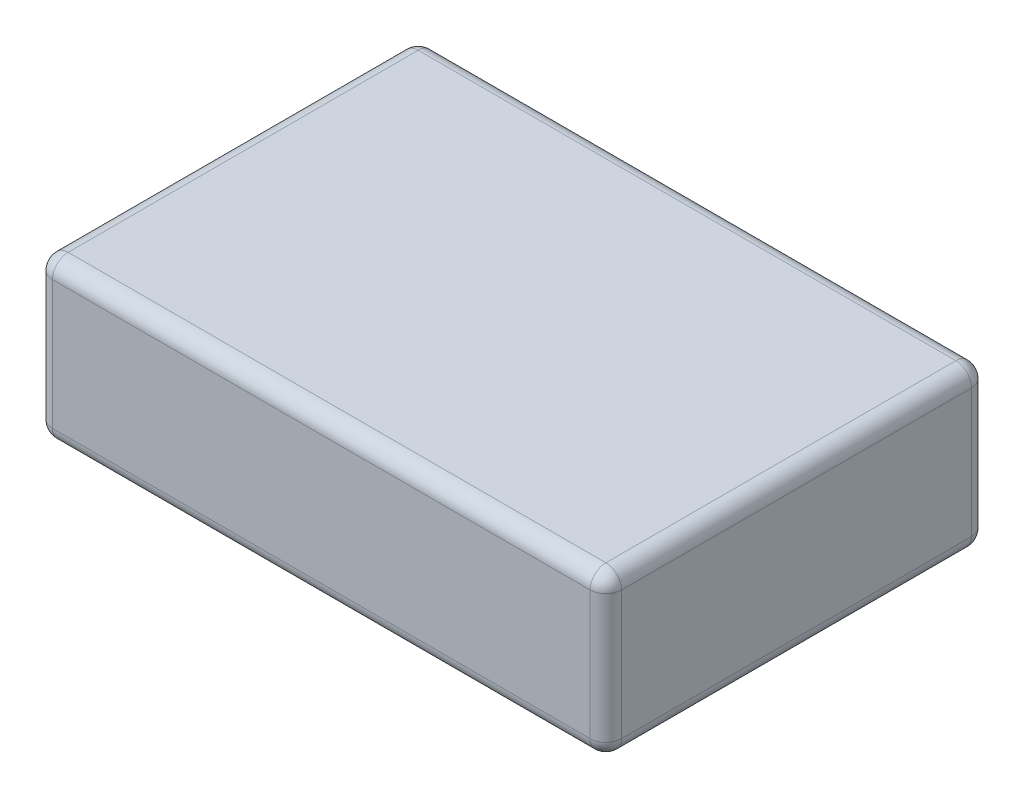
from build123d import *

# Parameters (mm, degrees)
SKETCH1_W           = 92.0242
SKETCH1_H           = 61.6712
BOSS_EXTRUDE1_DEPTH = 25.908
FILLET1_R           = 2.54


with BuildPart() as part:
    # Sketch1 → Boss-Extrude1 (new body)
    with BuildSketch(Plane(origin=(0, 0, 0), x_dir=(1, 0, 0), z_dir=(0, 1, 0))):
        Rectangle(SKETCH1_W, SKETCH1_H)
    extrude(amount=BOSS_EXTRUDE1_DEPTH)

    # Fillet1
    fillet1_edges = [part.edges().sort_by_distance(p)[0] for p in [
        (-46.0121, 25.908, 0),
        (0, 25.908, 30.8356),
        (46.0121, 25.908, 0),
        (0, 0, 30.8356),
        (-46.0121, 0, 0),
        (0, 0, -30.8356),
        (46.0121, 0, 0),
        (0, 25.908, -30.8356),
        (46.0121, 12.954, 30.8356),
        (-46.0121, 12.954, 30.8356),
        (-46.0121, 12.954, -30.8356),
        (46.0121, 12.954, -30.8356),
    ]]
    fillet(fillet1_edges, radius=FILLET1_R)


solid = part.part
